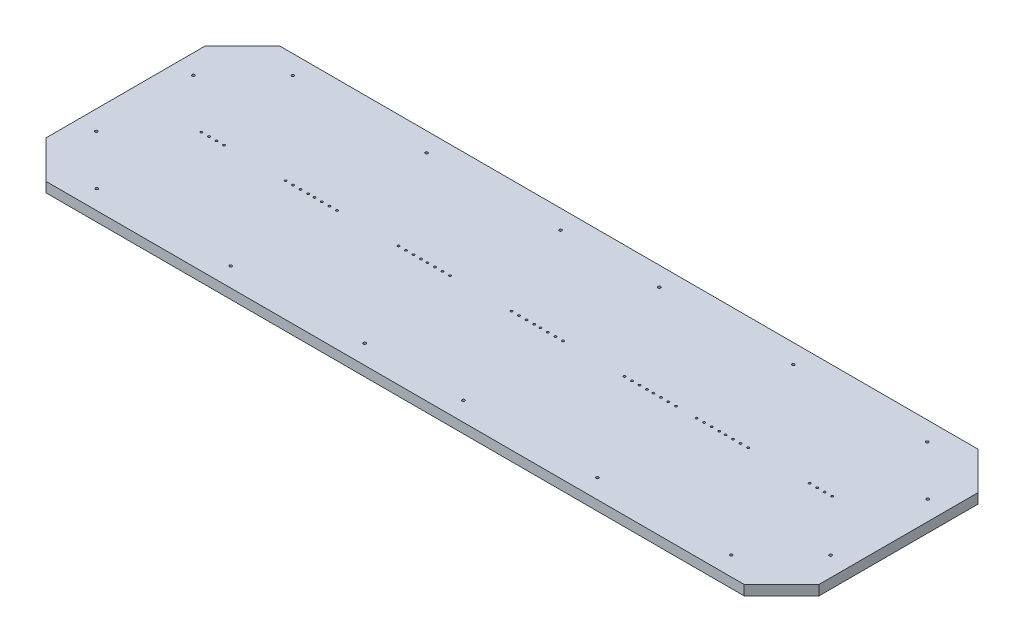
from build123d import *

# Parameters (mm, degrees)
BOSS_EXTRU_1_DEPTH                                 = 15.875
FRAISAGE_POUR_VIS_T_TE_FRAIS_E_BOMB_E_D            = 4.3053
FRAISAGE_POUR_VIS_T_TE_FRAIS_E_BOMB_E_CSINK_D      = 7.0866
FRAISAGE_POUR_VIS_T_TE_FRAIS_E_BOMB_E_CSINK_ANGLE  = 82
CHAMBRAGE_POUR_VIS_T_TE_RONDE_BOMB_E_M_D           = 3.4
CHAMBRAGE_POUR_VIS_T_TE_RONDE_BOMB_E_M_DEPTH       = 26
CHAMBRAGE_POUR_VIS_T_TE_RONDE_BOMB_E_M_CBORE_D     = 7
CHAMBRAGE_POUR_VIS_T_TE_RONDE_BOMB_E_M_CBORE_DEPTH = 8


with BuildPart() as part:
    # Esquisse1 → Boss.-Extru.1 (new body)
    with BuildSketch(Plane(origin=(0, 0, 0), x_dir=(1, 0, 0), z_dir=(0, 1, 0))):
        Polygon((-615.95, 126.475), (-615.95, -126.475), (-555.95, -186.475), (555.95, -186.475), (615.95, -126.475), (615.95, 126.475), (555.95, 186.475), (-555.95, 186.475), align=None)
    extrude(amount=BOSS_EXTRU_1_DEPTH)

    # Fraisage pour vis à tête fraisée bombée #61 (through all)
    with Locations(Plane(origin=(0, 0, 0), x_dir=(-1, 0, 0), z_dir=(0, -1, 0))):
        with Locations((292.100000899, -156.075), (78.700000899, -156.075), (505.500000899, -156.075), (584.875000899, -77.375), (78.700000899, 156.075), (292.100000899, 156.075), (505.500000899, 156.075), (584.875000899, 77.375), (-78.700000899, 156.075), (-292.100000899, 156.075), (-505.500000899, 156.075), (-584.875000899, 77.375), (-584.875000899, -77.375), (-505.500000899, -156.075), (-292.100000899, -156.075), (-78.700000899, -156.075)):
            CounterSinkHole(FRAISAGE_POUR_VIS_T_TE_FRAIS_E_BOMB_E_D / 2, FRAISAGE_POUR_VIS_T_TE_FRAIS_E_BOMB_E_CSINK_D / 2, counter_sink_angle=FRAISAGE_POUR_VIS_T_TE_FRAIS_E_BOMB_E_CSINK_ANGLE)

    # Chambrage pour vis à tête ronde bombée M31
    with Locations(Plane.XZ):
        with Locations((-487.99995981, -5.176513683), (-475.99995981, -5.176513683), (-463.99995981, -5.176513683), (-499.99995981, -5.176513683), (-365.99995981, -5.176513683), (-341.99995981, -5.176513683), (-353.99995981, -5.176513683), (-329.99995981, -5.176513683), (-319.99995981, -5.176513683), (-307.99995981, -5.176513683), (-295.99995981, -5.176513683), (-283.99995981, -5.176513683), (-185.99995981, -5.176513683), (-173.99995981, -5.176513683), (-161.99995981, -5.176513683), (-149.99995981, -5.176513683), (-139.99995981, -5.176513683), (-127.99995981, -5.176513683), (-115.99995981, -5.176513683), (-103.99995981, -5.176513683), (-5.99995981, -5.176513683), (6.00004019, -5.176513683), (18.00004019, -5.176513683), (30.00004019, -5.176513683), (40.00004019, -5.176513683), (52.00004019, -5.176513683), (76.00004019, -5.176513683), (64.00004019, -5.176513683), (174.00004019, -5.176513683), (186.00004019, -5.176513683), (198.00004019, -5.176513683), (210.00004019, -5.176513683), (220.00004019, -5.181795058), (232.00004019, -5.181795058), (244.00004019, -5.181795058), (256.00004019, -5.181795058), (289.00004019, -5.181795058), (301.00004019, -5.181795058), (313.00004019, -5.181795058), (325.00004019, -5.181795058), (335.00004019, -5.181795058), (347.00004019, -5.181795058), (359.00004019, -5.181795058), (371.00004019, -5.181795058), (469.00004019, -5.181795058), (481.00004019, -5.181795058), (493.00004019, -5.181795058), (505.00004019, -5.181795058)):
            CounterBoreHole(CHAMBRAGE_POUR_VIS_T_TE_RONDE_BOMB_E_M_D / 2, CHAMBRAGE_POUR_VIS_T_TE_RONDE_BOMB_E_M_CBORE_D / 2, CHAMBRAGE_POUR_VIS_T_TE_RONDE_BOMB_E_M_CBORE_DEPTH, depth=CHAMBRAGE_POUR_VIS_T_TE_RONDE_BOMB_E_M_DEPTH)


solid = part.part
